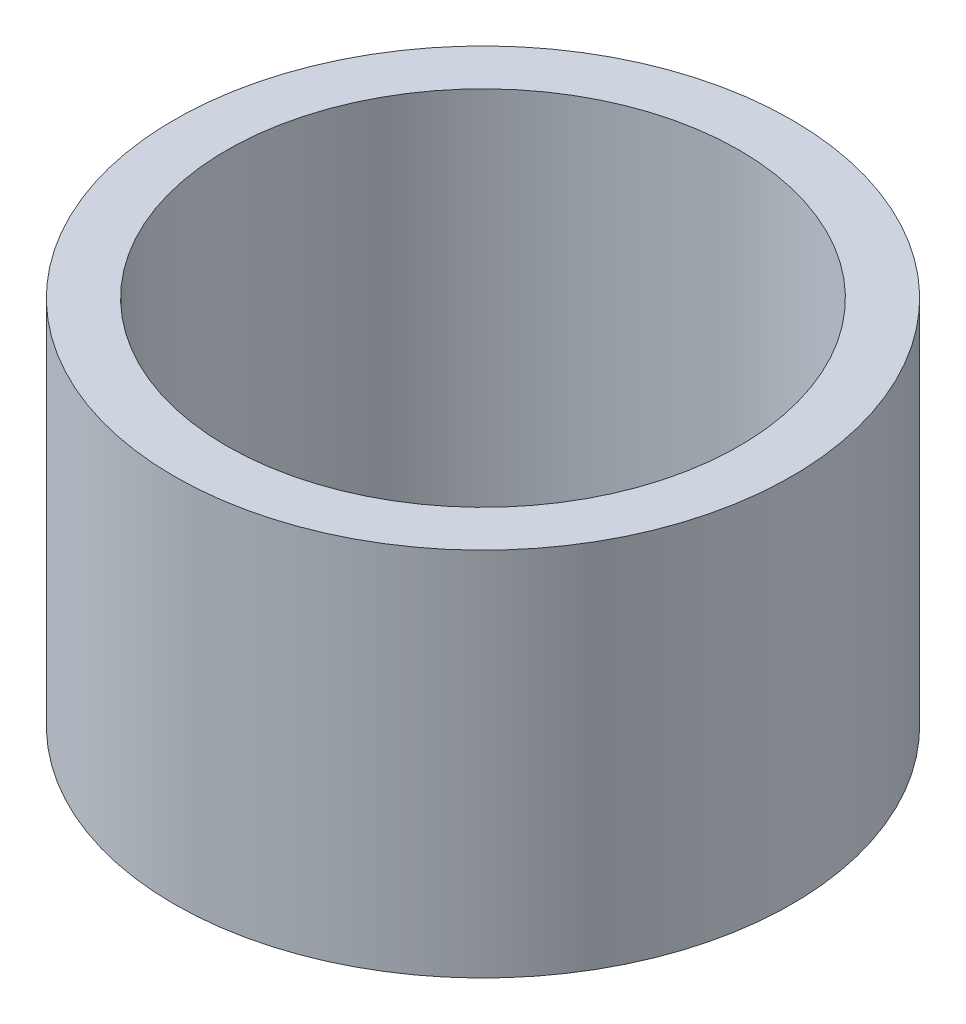
from build123d import *

# Parameters (mm, degrees)
SKETCH_1_W          = 10
SKETCH_1_H          = 12
SKETCH_2_R          = 4.3
AXIAL_BORE_DEPTH    = 19.547236991
SKETCH_3_R          = 8.3
D16_CLEARANCE_DEPTH = 19.547236991


with BuildPart() as part:
    # 草图1 → Round_pushrod_head (revolve)
    with BuildSketch(Plane.XY, mode=Mode.PRIVATE) as round_pushrod_head_sk:
        with Locations((5, 6)):
            Rectangle(SKETCH_1_W, SKETCH_1_H)
    revolve(round_pushrod_head_sk.sketch.rotate(Axis((0, 0, 0), (0, 1, 0)), 90), axis=Axis((0, 0, 0), (0, 1, 0)))

    # 草图2 → Axial_bore (cut, through all)
    with BuildSketch(Plane(origin=(0, 12, 0), x_dir=(1, 0, 0), z_dir=(0, 1, 0))):
        with Locations(Location((0, 0, 0), (0, 0, 270))):
            Circle(SKETCH_2_R)
    extrude(amount=-AXIAL_BORE_DEPTH, mode=Mode.SUBTRACT)

    # 草图3 → D16_clearance (cut, through all)
    with BuildSketch(Plane(origin=(0, 12, 0), x_dir=(1, 0, 0), z_dir=(0, 1, 0))):
        with Locations(Location((0, 0, 0), (0, 0, 270))):
            Circle(SKETCH_3_R)
    extrude(amount=-D16_CLEARANCE_DEPTH, mode=Mode.SUBTRACT)


solid = part.part
